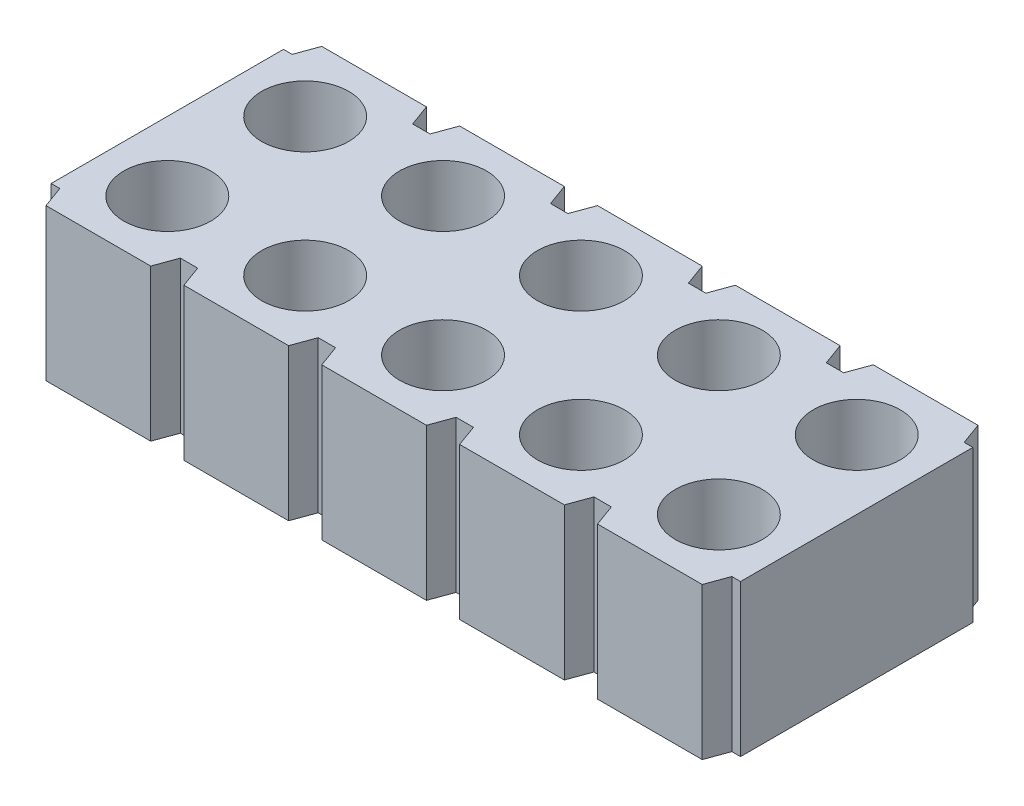
from build123d import *

# Parameters (mm, degrees)
EXTRUDE1_DEPTH       = 2.794
HOLE1_D              = 1.60274
EXTRUDE2_DEPTH       = 2.794
LPATTERN1_COUNT      = 5
LPATTERN1_PITCH      = 2.54
LPATTERN1_COUNT_DIR2 = 2
LPATTERN1_PITCH_DIR2 = 2.54
LPATTERN2_COUNT      = 35
LPATTERN2_PITCH      = 2.54


with BuildPart() as part:
    # Sketch1 → Extrude1 (new body)
    with BuildSketch(Plane(origin=(0, 0, 0), x_dir=(1, 0, 0), z_dir=(0, 1, 0))):
        Polygon((12.394373708, 0.40005), (12.234353708, 0.40005), (12.088747416, 0), (0, 0), (-0.145606292, 0.40005), (-0.305626292, 0.40005), (-0.305626292, 4.67995), (-0.145606292, 4.67995), (0, 5.08), (12.088747416, 5.08), (12.234353708, 4.67995), (12.394373708, 4.67995), align=None)
    extrude(amount=-EXTRUDE1_DEPTH)

    # Hole1 (through all)
    with Locations(Plane(origin=(0.964373708, 0, -1.27), x_dir=(0, 0, 1), z_dir=(0, 1, 0))):
        with Locations((0, 0)):
            hole1 = Hole(HOLE1_D / 2)

    # Sketch4 → Extrude2 (cut)
    with BuildSketch(Plane(origin=(0, 0, 0), x_dir=(1, 0, 0), z_dir=(0, 1, 0))):
        Polygon((1.928772816, 0), (2.5399746, 0), (2.394368308, 0.40005), (2.074379108, 0.40005), align=None)
        Polygon((2.074379108, 4.67995), (2.394368308, 4.67995), (2.5399746, 5.08), (1.928772816, 5.08), align=None)
    extrude2 = extrude(amount=-EXTRUDE2_DEPTH, mode=Mode.SUBTRACT)

    # LPattern1: Hole1 5 × 2
    with Locations(*[(i * LPATTERN1_PITCH, 0, -j * LPATTERN1_PITCH_DIR2) for i in range(LPATTERN1_COUNT) for j in range(LPATTERN1_COUNT_DIR2) if (i, j) != (0, 0)]):
        add(hole1, mode=Mode.SUBTRACT)

    # LPattern2: Extrude2 ×35
    with Locations(*[(i * LPATTERN2_PITCH, 0, 0) for i in range(1, LPATTERN2_COUNT)]):
        add(extrude2, mode=Mode.SUBTRACT)


solid = part.part
